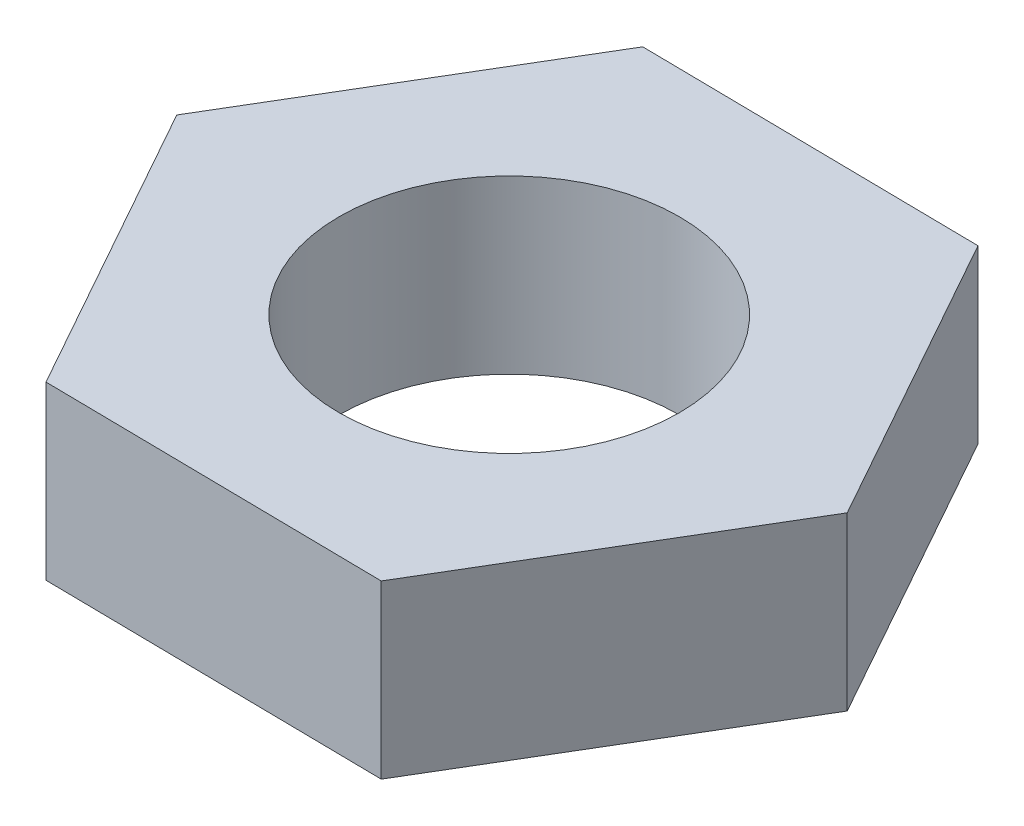
from build123d import *

# Parameters (mm, degrees)
BOSS_EXTRUDE1_DEPTH = 2.5654
SKETCH3_R           = 2.54
CUT_EXTRUDE1_DEPTH  = 12.732254183


with BuildPart() as part:
    # Sketch1 → Boss-Extrude1 (new body)
    with BuildSketch(Plane(origin=(0, 0, 0), x_dir=(1, 0, 0), z_dir=(0, 1, 0))):
        Polygon((7.571768909, 5.410935572), (2.492244656, 5.48045797), (-0.107725633, 1.116222127), (2.37182833, -3.317536114), (7.451352583, -3.387058513), (10.051322872, 0.97717733), align=None)
    extrude(amount=BOSS_EXTRUDE1_DEPTH)

    # Sketch3 → Cut-Extrude1 (cut, through all)
    with BuildSketch(Plane(origin=(0, 2.5654, 0), x_dir=(1, 0, 0), z_dir=(0, 1, 0))):
        with Locations(Location((4.961568222, 1.015411397, 0), (0, 0, 270))):
            Circle(SKETCH3_R)
    extrude(amount=-CUT_EXTRUDE1_DEPTH, mode=Mode.SUBTRACT)


solid = part.part
